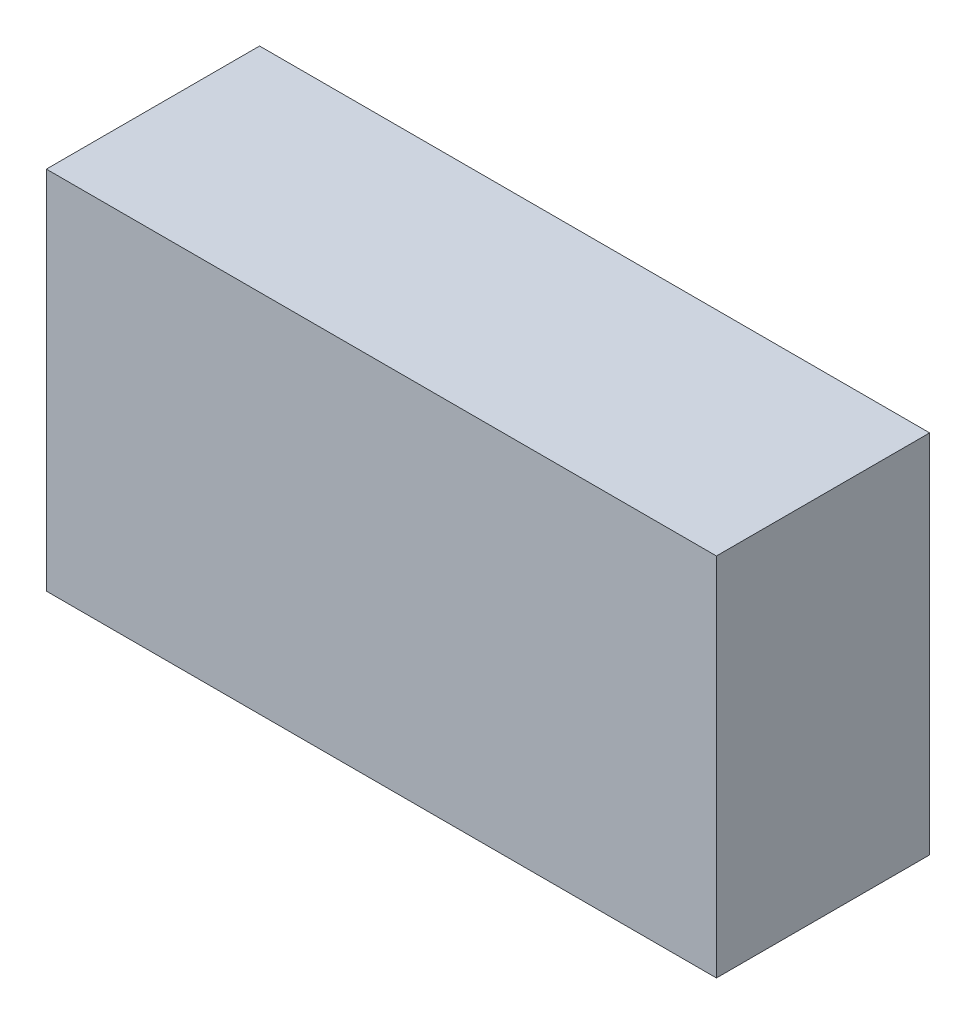
from build123d import *

# Parameters (mm, degrees)
SKIZZE1_W                       = 110
SKIZZE1_H                       = 60
AUFSATZ_LINEAR_AUSTRAGEN1_DEPTH = 35
SCHALE1_T                       = -1.5
SKIZZE3_W                       = 9
SKIZZE3_H                       = 5
SCHNITT_LINEAR_AUSTRAGEN1_DEPTH = 35


with BuildPart() as part:
    # Skizze1 → Aufsatz-Linear austragen1 (new body)
    with BuildSketch(Plane.XY):
        Rectangle(SKIZZE1_W, SKIZZE1_H)
    extrude(amount=AUFSATZ_LINEAR_AUSTRAGEN1_DEPTH)

    # Schale1
    schale1_openings = [part.faces().sort_by_distance(p)[0] for p in [
        (0, 0, 0),
    ]]
    offset(amount=SCHALE1_T, openings=schale1_openings, kind=Kind.INTERSECTION)

    # Skizze3 → Schnitt-Linear austragen1 (cut)
    with BuildSketch(Plane.ZY.offset(55)):
        with BuildLine():
            Line((0, -10.5), (0, -15.5))
            ThreePointArc((0, -15.5), (2.5, -13), (0, -10.5))
        make_face()
        with Locations((11.5, 12.5)):
            Rectangle(SKIZZE3_W, SKIZZE3_H)
    extrude(amount=-SCHNITT_LINEAR_AUSTRAGEN1_DEPTH, mode=Mode.SUBTRACT)


solid = part.part
